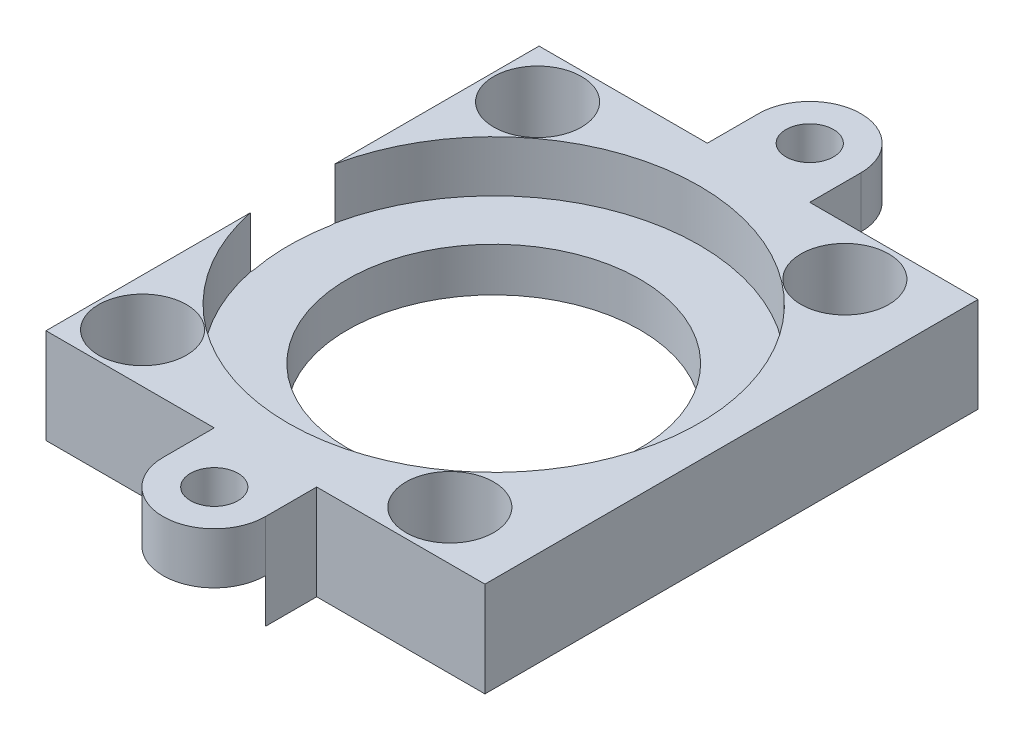
from build123d import *

# Parameters (mm, degrees)
SKETCH1_R           = 1.375
SKETCH1_R_2         = 1.460845326
SKETCH1_R_3         = 1.480655282
BOSS_EXTRUDE1_DEPTH = 15
BOSS_EXTRUDE2_START = -8
SKETCH2_R           = 14
SKETCH2_R_2         = 10
BOSS_EXTRUDE2_DEPTH = 8
CUT_EXTRUDE1_START  = -3
SKETCH3_R           = 14
SKETCH3_R_2         = 10
CUT_EXTRUDE1_DEPTH  = 3
SKETCH5_R           = 1.480655282
SKETCH5_R_2         = 1.375
SKETCH5_R_3         = 1.460845326
BOSS_EXTRUDE3_DEPTH = 0.5
SKETCH6_W           = 32.415484222
SKETCH6_H           = 34.71462202
CUT_EXTRUDE2_DEPTH  = 7
SKETCH7_W           = 33.435139342
SKETCH7_H           = 35.82697306
CUT_EXTRUDE3_DEPTH  = 2
BOSS_EXTRUDE4_DEPTH = 6.5
SKETCH9_R           = 3.5
SKETCH9_R_2         = 1.625
CUT_EXTRUDE4_DEPTH  = 3
SKETCH10_R          = 3
CUT_EXTRUDE5_DEPTH  = 28
SKETCH11_R          = 14.05
CUT_EXTRUDE6_DEPTH  = 3.5


with BuildPart() as part:
    # Sketch1 → Boss-Extrude1 (new body)
    with BuildSketch(Plane(origin=(0, 0, 0), x_dir=(1, 0, 0), z_dir=(0, 1, 0))):
        with BuildLine():
            Line((-15, -16.85), (15, -16.85))
            Line((15, -16.85), (15, 16.85))
            Line((15, 16.85), (-15, 16.85))
            Line((-15, 16.85), (-15, 2.633913438))
            ThreePointArc((-15, 2.633913438), (0.072875656, 13.937359865), (12.75, 0))
            ThreePointArc((12.75, 0), (0.072875656, -13.937359865), (-15, -2.633913438))
            Line((-15, -2.633913438), (-15, -16.85))
        make_face()
        with Locations(Location((-11.75, -13.5, 0), (0, 0, 270))):
            Circle(SKETCH1_R, mode=Mode.SUBTRACT)
        with Locations(Location((9.25, -13.5, 0), (0, 0, 270))):
            Circle(SKETCH1_R_2, mode=Mode.SUBTRACT)
        with Locations(Location((-11.75, 13.5, 0), (0, 0, 270))):
            Circle(SKETCH1_R, mode=Mode.SUBTRACT)
        with Locations(Location((9.25, 13.5, 0), (0, 0, 270))):
            Circle(SKETCH1_R_3, mode=Mode.SUBTRACT)
    extrude(amount=BOSS_EXTRUDE1_DEPTH)

    # Sketch2 → Boss-Extrude2 (add)
    with BuildSketch(Plane(origin=(0, 15, 0), x_dir=(1, 0, 0), z_dir=(0, 1, 0)).offset(BOSS_EXTRUDE2_START)):
        with Locations((-1.25, 0)):
            Circle(SKETCH2_R)
        with Locations(Location((-1.25, 0, 0), (0, 0, 270))):
            Circle(SKETCH2_R_2, mode=Mode.SUBTRACT)
    extrude(amount=BOSS_EXTRUDE2_DEPTH)

    # Sketch3 → Cut-Extrude1 (cut)
    with BuildSketch(Plane(origin=(0, 15, 0), x_dir=(1, 0, 0), z_dir=(0, 1, 0)).offset(CUT_EXTRUDE1_START)):
        with Locations((-1.25, 0)):
            Circle(SKETCH3_R)
        with Locations(Location((-1.25, 0, 0), (0, 0, 270))):
            Circle(SKETCH3_R_2, mode=Mode.SUBTRACT)
    extrude(amount=CUT_EXTRUDE1_DEPTH, mode=Mode.SUBTRACT)

    # Sketch5 → Boss-Extrude3 (add)
    with BuildSketch(Plane(origin=(0, 15, 0), x_dir=(1, 0, 0), z_dir=(0, 1, 0))):
        with BuildLine():
            Line((-15, 16.85), (-15, 2.633913438))
            ThreePointArc((-15, 2.633913438), (12.75, 0), (-15, -2.633913438))
            Line((-15, -2.633913438), (-15, -16.85))
            Line((-15, -16.85), (15, -16.85))
            Line((15, -16.85), (15, 16.85))
            Line((15, 16.85), (-15, 16.85))
        make_face()
        with Locations(Location((9.25, 13.5, 0), (0, 0, 270))):
            Circle(SKETCH5_R, mode=Mode.SUBTRACT)
        with Locations(Location((-11.75, -13.5, 0), (0, 0, 270))):
            Circle(SKETCH5_R_2, mode=Mode.SUBTRACT)
        with Locations(Location((-11.75, 13.5, 0), (0, 0, 270))):
            Circle(SKETCH5_R_2, mode=Mode.SUBTRACT)
        with Locations(Location((9.25, -13.5, 0), (0, 0, 270))):
            Circle(SKETCH5_R_3, mode=Mode.SUBTRACT)
    extrude(amount=BOSS_EXTRUDE3_DEPTH)

    # Sketch6 → Cut-Extrude2 (cut)
    with BuildSketch(Plane.XZ):
        Rectangle(SKETCH6_W, SKETCH6_H)
    extrude(amount=-CUT_EXTRUDE2_DEPTH, mode=Mode.SUBTRACT)

    # Sketch7 → Cut-Extrude3 (cut)
    with BuildSketch(Plane.XZ.offset(-7)):
        Rectangle(SKETCH7_W, SKETCH7_H)
    extrude(amount=-CUT_EXTRUDE3_DEPTH, mode=Mode.SUBTRACT)

    # Sketch8 → Boss-Extrude4 (add)
    with BuildSketch(Plane.XZ.offset(-9)):
        with BuildLine():
            Line((3.5, 16.85), (3.5, 20.35))
            ThreePointArc((3.5, 20.35), (2.474873725, 17.875126257), (-2.6e-08, 16.85))
            Line((-2.6e-08, 16.85), (3.5, 16.85))
        make_face()
        with BuildLine():
            ThreePointArc((-2.6e-08, 16.85), (-2.474873743, 17.875126275), (-3.5, 20.35))
            Line((-3.5, 20.35), (-3.5, 16.85))
            Line((-3.5, 16.85), (-2.6e-08, 16.85))
        make_face()
        with BuildLine():
            ThreePointArc((-1.625, 20.35), (0, 21.975), (1.625, 20.35))
            Line((1.625, 20.35), (3.5, 20.35))
            ThreePointArc((3.5, 20.35), (0, 23.85), (-3.5, 20.35))
            Line((-3.5, 20.35), (-1.625, 20.35))
        make_face()
        with BuildLine():
            Line((3.5, 20.35), (1.625, 20.35))
            ThreePointArc((1.625, 20.35), (0, 18.725), (-1.625, 20.35))
            Line((-1.625, 20.35), (-3.5, 20.35))
            ThreePointArc((-3.5, 20.35), (-2.474873743, 17.875126275), (-2.6e-08, 16.85))
            ThreePointArc((-2.6e-08, 16.85), (2.474873725, 17.875126257), (3.5, 20.35))
        make_face()
        with BuildLine():
            Line((3.5, -20.35), (3.5, -16.85))
            Line((3.5, -16.85), (0, -16.85))
            ThreePointArc((0, -16.85), (2.474873734, -17.875126266), (3.5, -20.35))
        make_face()
        with BuildLine():
            ThreePointArc((-3.5, -20.35), (-2.474873734, -17.875126266), (0, -16.85))
            Line((0, -16.85), (-3.5, -16.85))
            Line((-3.5, -16.85), (-3.5, -20.35))
        make_face()
        with BuildLine():
            ThreePointArc((-3.5, -20.35), (0, -23.85), (3.5, -20.35))
            Line((3.5, -20.35), (1.625, -20.35))
            ThreePointArc((1.625, -20.35), (0, -21.975), (-1.625, -20.35))
            Line((-1.625, -20.35), (-3.5, -20.35))
        make_face()
        with BuildLine():
            Line((1.625, -20.35), (3.5, -20.35))
            ThreePointArc((3.5, -20.35), (2.474873734, -17.875126266), (0, -16.85))
            ThreePointArc((0, -16.85), (-2.474873734, -17.875126266), (-3.5, -20.35))
            Line((-3.5, -20.35), (-1.625, -20.35))
            ThreePointArc((-1.625, -20.35), (0, -18.725), (1.625, -20.35))
        make_face()
    extrude(amount=-BOSS_EXTRUDE4_DEPTH)

    # Sketch9 → Cut-Extrude4 (cut)
    # profile 1 of 2: a face of its own
    with BuildSketch(Plane.XZ.offset(-9)):
        with Locations((0, 20.35)):
            Circle(SKETCH9_R)
        with Locations(Location((0, 20.35, 0), (0, 0, 270))):
            Circle(SKETCH9_R_2, mode=Mode.SUBTRACT)
    # profile 2 of 2: a face of its own
    with BuildSketch(Plane.XZ.offset(-9)):
        with Locations((0, -20.35)):
            Circle(SKETCH9_R)
        with Locations(Location((0, -20.35, 0), (0, 0, 270))):
            Circle(SKETCH9_R_2, mode=Mode.SUBTRACT)
    extrude(amount=-CUT_EXTRUDE4_DEPTH, mode=Mode.SUBTRACT)

    # Sketch10 → Cut-Extrude5 (cut)
    with BuildSketch(Plane.XZ.offset(-9)):
        with Locations(Location((-11.75, 13.5, 0), (0, 0, 270))):
            Circle(SKETCH10_R)
        with Locations(Location((9.25, 13.5, 0), (0, 0, 270))):
            Circle(SKETCH10_R)
        with Locations(Location((9.25, -13.5, 0), (0, 0, 270))):
            Circle(SKETCH10_R)
        with Locations(Location((-11.75, -13.5, 0), (0, 0, 270))):
            Circle(SKETCH10_R)
    extrude(amount=-CUT_EXTRUDE5_DEPTH, mode=Mode.SUBTRACT)

    # Sketch11 → Cut-Extrude6 (cut)
    with BuildSketch(Plane(origin=(0, 15.5, 0), x_dir=(1, 0, 0), z_dir=(0, 1, 0))):
        with Locations((-1.25, 0)):
            Circle(SKETCH11_R)
    extrude(amount=-CUT_EXTRUDE6_DEPTH, mode=Mode.SUBTRACT)


solid = part.part
